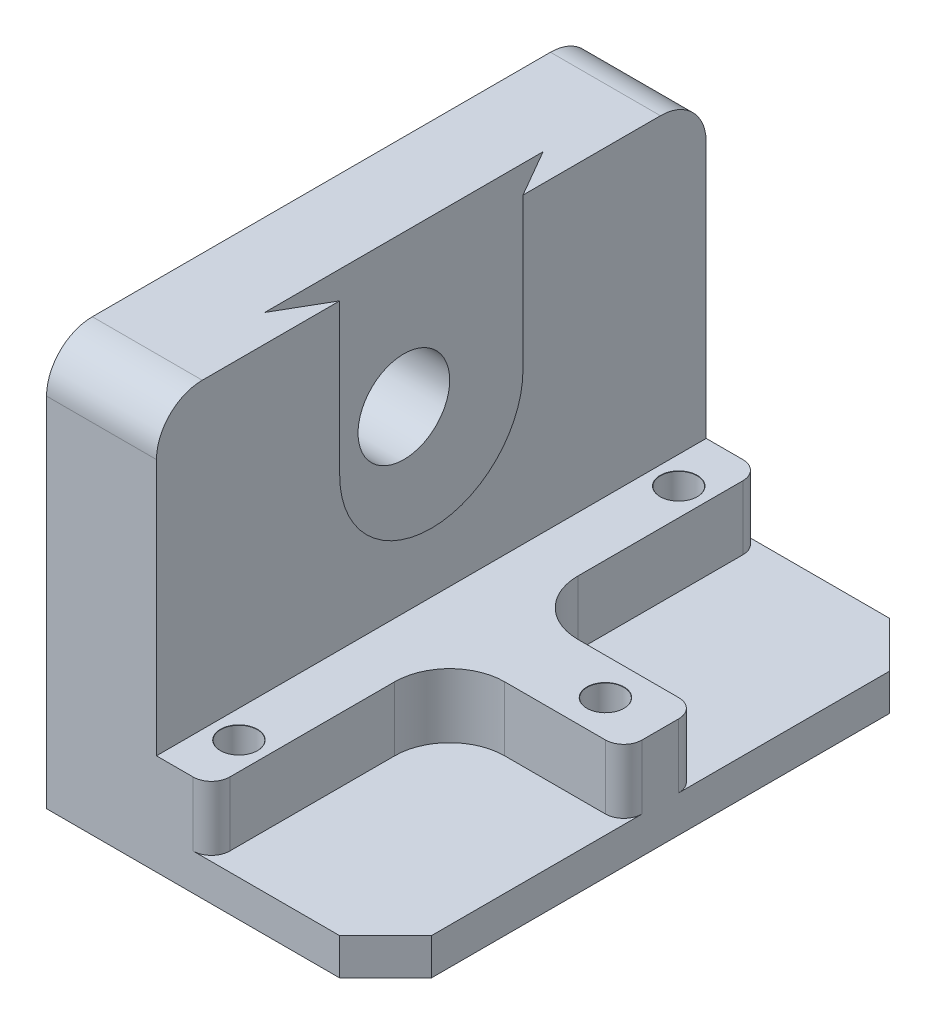
from build123d import *

# Parameters (mm, degrees)
ESTRUSIONE_ESTRUSIONE1_DEPTH = 30
ESTRUSIONE_ESTRUSIONE2_DEPTH = 7
FORO_10_0_10_1_D             = 10
FORO_10_0_10_1_CSINK_D       = 10.05
FORO_10_0_10_1_CSINK_ANGLE   = 90
FORO_4_0_4_1_D               = 4
FORO_4_0_4_1_CSINK_D         = 4.05
FORO_4_0_4_1_CSINK_ANGLE     = 90
SMUSSO1_SIZE                 = 5
RACCORDO1_R                  = 2
RACCORDO2_R                  = 6
RACCORDO3_R                  = 5
TAGLIO_ESTRUSIONE4_DEPTH     = 3
TAGLIO_ESTRUSIONE4_DRAFT     = 60


with BuildPart() as part:
    # Schizzo1 → Estrusione-Estrusione1 (new, symmetric)
    with BuildSketch(Plane.XY):
        Polygon((0, 44), (0, 0), (37, 0), (37, 4), (12, 4), (12, 44), align=None)
    extrude(amount=ESTRUSIONE_ESTRUSIONE1_DEPTH, both=True)

    # Schizzo3 → Estrusione-Estrusione2 (add)
    with BuildSketch(Plane(origin=(0, 4, 0), x_dir=(1, 0, 0), z_dir=(0, 1, 0))):
        Polygon((12, 30), (18, 30), (18, 4), (37, 4), (37, -4), (18, -4), (18, -30), (12, -30), align=None)
    extrude(amount=ESTRUSIONE_ESTRUSIONE2_DEPTH)

    # Foro Ø10.0 (10)-1 (through all)
    with Locations(Plane(origin=(12, 27.5, 0), x_dir=(0, 0, 1), z_dir=(1, 0, 0))):
        with Locations((0, 0)):
            CounterSinkHole(FORO_10_0_10_1_D / 2, FORO_10_0_10_1_CSINK_D / 2, counter_sink_angle=FORO_10_0_10_1_CSINK_ANGLE)

    # Foro Ø4.0 (4)-1 (through all)
    with Locations(Plane(origin=(15, 11, -24), x_dir=(1, 0, 0), z_dir=(0, 1, 0))):
        with Locations((0, 0), (16, -24), (0, -48)):
            CounterSinkHole(FORO_4_0_4_1_D / 2, FORO_4_0_4_1_CSINK_D / 2, counter_sink_angle=FORO_4_0_4_1_CSINK_ANGLE)

    # Smusso1
    smusso1_edges = [part.edges().sort_by_distance(p)[0] for p in [
        (37, 2, 30),
        (37, 2, -30),
    ]]
    chamfer(smusso1_edges, length=SMUSSO1_SIZE)

    # Raccordo1
    raccordo1_edges = [part.edges().sort_by_distance(p)[0] for p in [
        (18, 7.5, 30),
        (37, 7.5, 4),
        (37, 7.5, -4),
        (18, 7.5, -30),
    ]]
    fillet(raccordo1_edges, radius=RACCORDO1_R)

    # Raccordo2
    raccordo2_edges = [part.edges().sort_by_distance(p)[0] for p in [
        (18, 7.5, 4),
        (18, 7.5, -4),
    ]]
    fillet(raccordo2_edges, radius=RACCORDO2_R)

    # Raccordo3
    raccordo3_edges = [part.edges().sort_by_distance(p)[0] for p in [
        (6, 44, 30),
        (6, 44, -30),
    ]]
    fillet(raccordo3_edges, radius=RACCORDO3_R)


with BuildPart() as taglio_estrusione4_tool:
    # Schizzo2 → Taglio-Estrusione4 (with draft: the straight prism first)
    with BuildSketch(Plane(origin=(12, 0, 0), x_dir=(0, 0, -1), z_dir=(1, 0, 0))):
        with BuildLine():
            Line((-10, 42.375961669), (-10, 27.5))
            ThreePointArc((-10, 27.5), (0, 17.5), (10, 27.5))
            Line((10, 27.5), (10, 42.375961669))
            Line((10, 42.375961669), (10, 44))
            Line((10, 44), (-10, 44))
            Line((-10, 44), (-10, 42.375961669))
        make_face()
    extrude(amount=-TAGLIO_ESTRUSIONE4_DEPTH)
    # Taglio-Estrusione4: the draft: its side faces are tilted about the plane it starts from
    taglio_estrusione4_sides = [taglio_estrusione4_tool.faces().sort_by_distance(p)[0] for p in [
        (10.5, 35.75, 10),
        (10.5, 35.75, -10),
        (10.5, 44, 0),
        (10.5, 17.5, 0),
    ]]
    draft(taglio_estrusione4_sides, Plane(origin=(12, 0, 0), x_dir=(0, 0, -1), z_dir=(1, 0, 0)), TAGLIO_ESTRUSIONE4_DRAFT)


with BuildPart() as part_1:
    add(part.part)

    # Taglio-Estrusione4: cut by taglio_estrusione4_tool
    add(taglio_estrusione4_tool.part, mode=Mode.SUBTRACT)


solid = part_1.part
